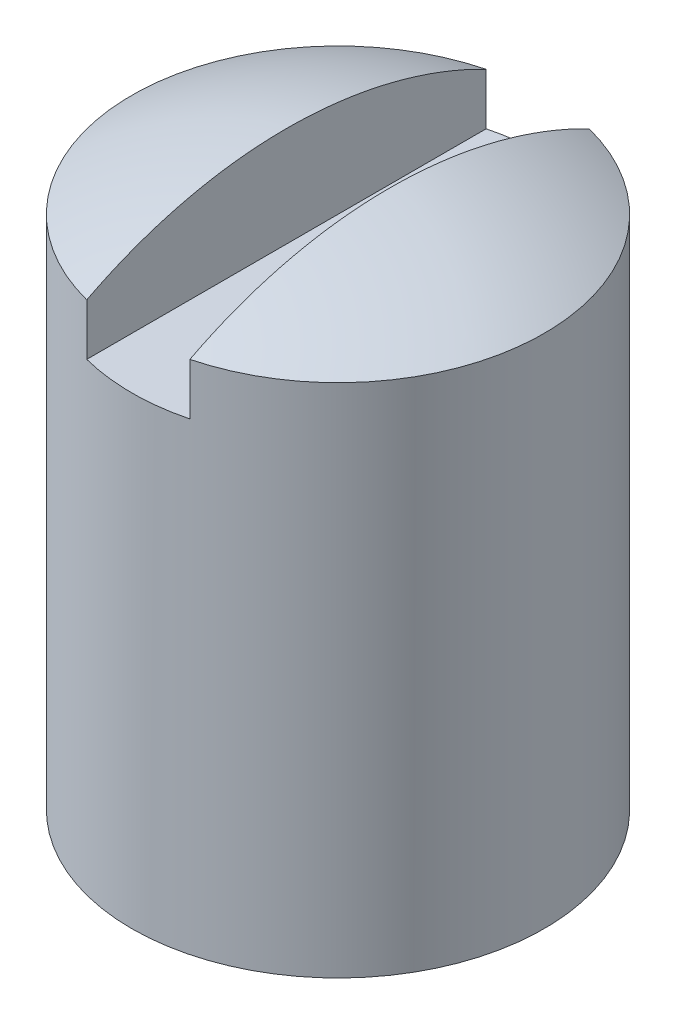
from build123d import *

# Parameters (mm, degrees)
SKETCH_2_W          = 2
SKETCH_2_H          = 2.409546764
CUT_EXTRUDE_1_DEPTH = 5


with BuildPart() as part:
    # 草圖1 → 旋轉1 (revolve)
    with BuildSketch(Plane.XY, mode=Mode.PRIVATE) as revolve_1_sk:
        with BuildLine():
            Line((-4, 12.5), (-4, 2.5))
            Line((-4, 2.5), (-1.834936491, 1.25))
            Line((-1.834936491, 1.25), (0, 1.25))
            Line((0, 1.25), (0, 13.5))
            ThreePointArc((0, 13.5), (-2.061552813, 13.246211251), (-4, 12.5))
        make_face()
    revolve(revolve_1_sk.sketch.rotate(Axis((0, 0, 0), (0, 1, 0)), 270), axis=Axis((0, 0, 0), (0, 1, 0)))

    # 草圖2 → 除料-伸長1 (cut, symmetric)
    with BuildSketch(Plane.XY):
        with Locations((0, 12.704773382)):
            Rectangle(SKETCH_2_W, SKETCH_2_H)
    extrude(amount=CUT_EXTRUDE_1_DEPTH, both=True, mode=Mode.SUBTRACT)


solid = part.part
